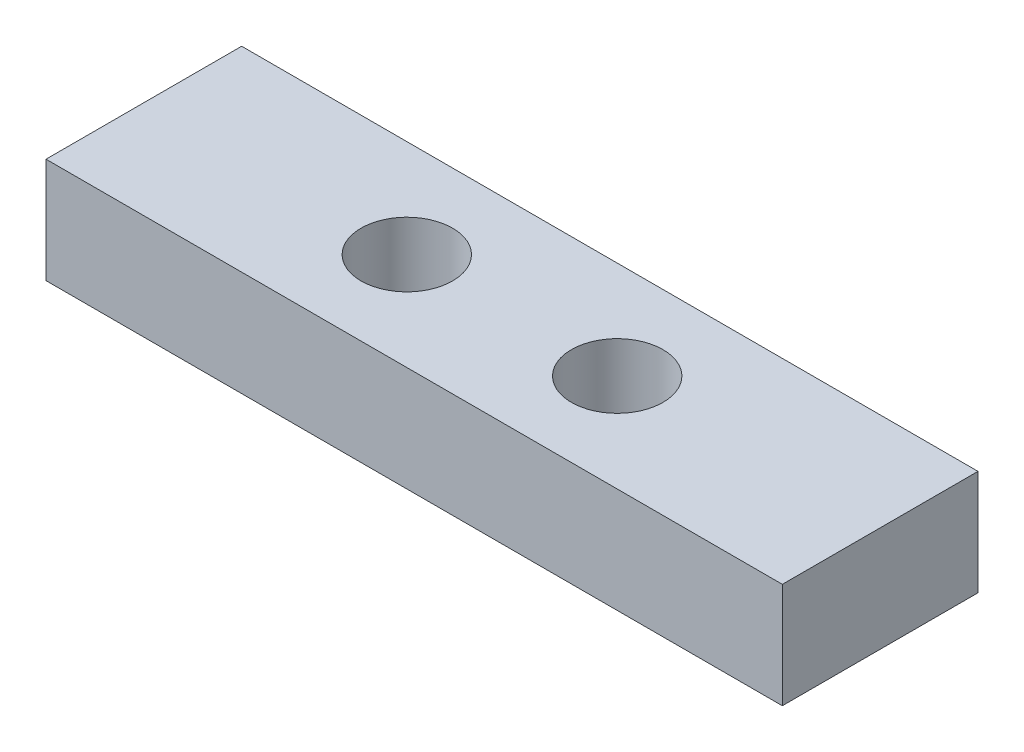
from build123d import *

# Parameters (mm, degrees)
SKETCH_1_W      = 35
SKETCH_1_H      = 9.3
SKETCH_1_R      = 2.175
EXTRUDE_1_DEPTH = 5


with BuildPart() as part:
    # 草图1 → 凸台-拉伸1 (new body)
    with BuildSketch(Plane(origin=(0, 0, 0), x_dir=(1, 0, 0), z_dir=(0, 1, 0))):
        Rectangle(SKETCH_1_W, SKETCH_1_H)
        with Locations(Location((-5, 0, 0), (0, 0, 270))):
            Circle(SKETCH_1_R, mode=Mode.SUBTRACT)
        with Locations(Location((5, 0, 0), (0, 0, 90))):
            Circle(SKETCH_1_R, mode=Mode.SUBTRACT)
    extrude(amount=EXTRUDE_1_DEPTH)


solid = part.part
